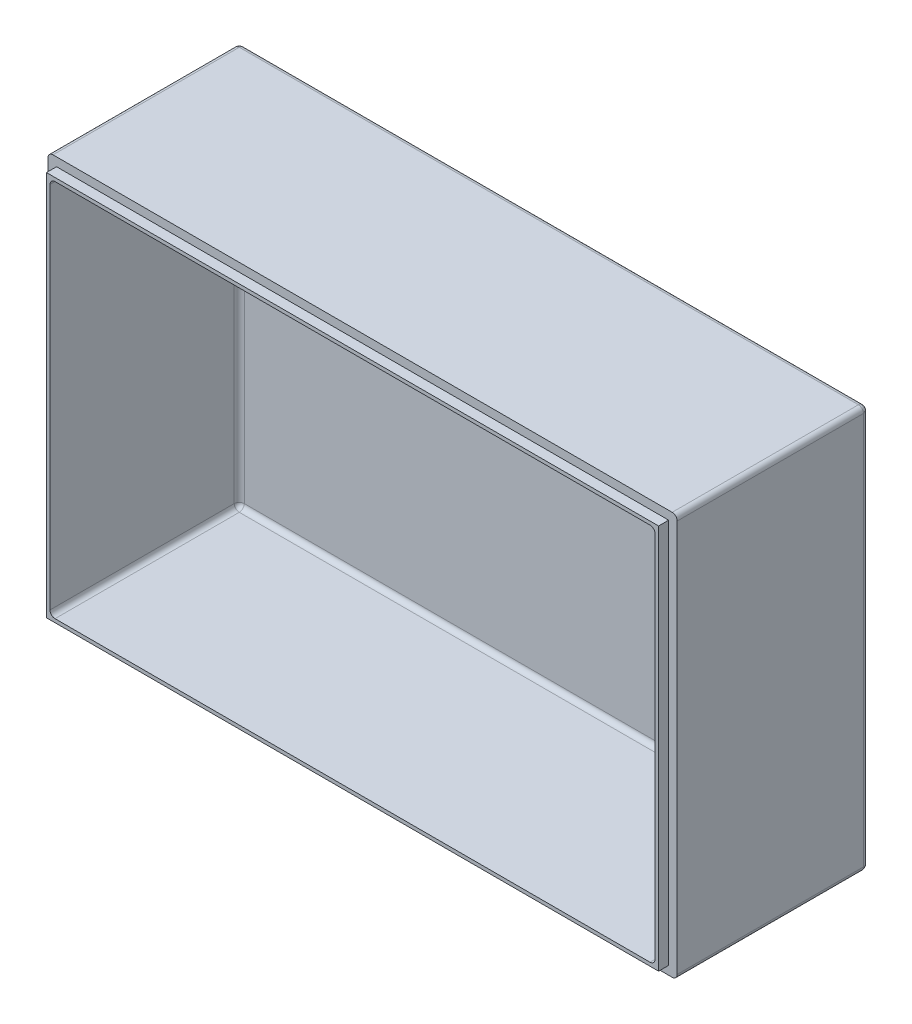
from build123d import *

# Parameters (mm, degrees)
SKETCH_1_W          = 125
SKETCH_1_H          = 80
EXTRUDE_1_DEPTH     = 40
SKETCH_2_W          = 120.2
SKETCH_2_H          = 75.2
CUT_EXTRUDE_1_DEPTH = 37.6
FILLET_1_R          = 1
FILLET_2_R          = 1
SKETCH_7_W          = 121.6
SKETCH_7_H          = 76.6
CUT_EXTRUDE_4_DEPTH = 2


with BuildPart() as part:
    # Эскиз1 → Бобышка-Вытянуть1 (new body)
    with BuildSketch(Plane.XY):
        Rectangle(SKETCH_1_W, SKETCH_1_H)
    extrude(amount=EXTRUDE_1_DEPTH)

    # Эскиз2 → Вырез-Вытянуть1 (cut)
    with BuildSketch(Plane.XY.offset(40)):
        Rectangle(SKETCH_2_W, SKETCH_2_H)
    extrude(amount=-CUT_EXTRUDE_1_DEPTH, mode=Mode.SUBTRACT)

    # Скругление1
    fillet_1_edges = [part.edges().sort_by_distance(p)[0] for p in [
        (0, -40, 0),
        (-62.5, 0, 0),
        (0, 40, 0),
        (62.5, 0, 0),
        (62.5, -40, 20),
        (-62.5, -40, 20),
        (-62.5, 40, 20),
        (62.5, 40, 20),
    ]]
    fillet(fillet_1_edges, radius=FILLET_1_R)

    # Скругление2
    fillet_2_edges = [part.edges().sort_by_distance(p)[0] for p in [
        (60.1, 0, 2.4),
        (60.1, 37.6, 21.2),
        (0, -37.6, 2.4),
        (60.1, -37.6, 21.2),
        (-60.1, 0, 2.4),
        (-60.1, -37.6, 21.2),
        (0, 37.6, 2.4),
        (-60.1, 37.6, 21.2),
    ]]
    fillet(fillet_2_edges, radius=FILLET_2_R)

    # Эскиз7 → Вырез-Вытянуть4 (cut)
    with BuildSketch(Plane.XY.offset(40)):
        with BuildLine():
            ThreePointArc((-62.5, -39), (-62.207106781, -39.707106781), (-61.5, -40))
            Line((-61.5, -40), (61.5, -40))
            ThreePointArc((61.5, -40), (62.207106781, -39.707106781), (62.5, -39))
            Line((62.5, -39), (62.5, 39))
            ThreePointArc((62.5, 39), (62.207106781, 39.707106781), (61.5, 40))
            Line((61.5, 40), (-61.5, 40))
            ThreePointArc((-61.5, 40), (-62.207106781, 39.707106781), (-62.5, 39))
            Line((-62.5, 39), (-62.5, -39))
        make_face()
        Rectangle(SKETCH_7_W, SKETCH_7_H, mode=Mode.SUBTRACT)
    extrude(amount=-CUT_EXTRUDE_4_DEPTH, mode=Mode.SUBTRACT)


solid = part.part
